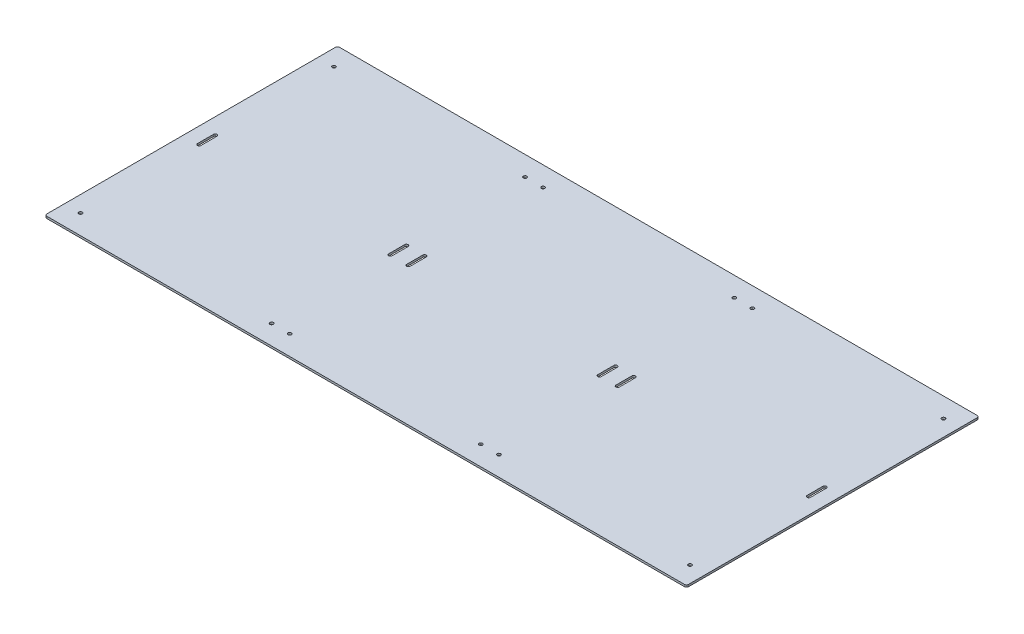
from build123d import *

# Parameters (mm, degrees)
SKETCH1_R           = 5.3578125
BOSS_EXTRUDE1_DEPTH = 6.35


with BuildPart() as part:
    # Sketch1 → Boss-Extrude1 (new body)
    with BuildSketch(Plane(origin=(0, 0, 0), x_dir=(1, 0, 0), z_dir=(0, 1, 0))):
        with BuildLine():
            Line((6.35, 0), (2019.3, 0))
            ThreePointArc((2019.3, 0), (2023.790128061, 1.859871939), (2025.65, 6.35))
            Line((2025.65, 6.35), (2025.65, 917.575))
            ThreePointArc((2025.65, 917.575), (2023.790128061, 922.065128061), (2019.3, 923.925))
            Line((2019.3, 923.925), (6.35, 923.925))
            ThreePointArc((6.35, 923.925), (1.859871939, 922.065128061), (0, 917.575))
            Line((0, 917.575), (0, 6.35))
            ThreePointArc((0, 6.35), (1.859871939, 1.859871939), (6.35, 0))
        make_face()
        with Locations(Location((50.8, 862.0125, 0), (0, 0, 270))):
            Circle(SKETCH1_R, mode=Mode.SUBTRACT)
        with Locations(Location((1974.85, 862.0125, 0), (0, 0, 270))):
            Circle(SKETCH1_R, mode=Mode.SUBTRACT)
        with Locations(Location((1974.85, 61.9125, 0), (0, 0, 270))):
            Circle(SKETCH1_R, mode=Mode.SUBTRACT)
        with Locations(Location((50.8, 61.9125, 0), (0, 0, 270))):
            Circle(SKETCH1_R, mode=Mode.SUBTRACT)
        with Locations(Location((654.05, 862.0125, 0), (0, 0, 270))):
            Circle(SKETCH1_R, mode=Mode.SUBTRACT)
        with Locations(Location((1371.6, 862.0125, 0), (0, 0, 270))):
            Circle(SKETCH1_R, mode=Mode.SUBTRACT)
        with Locations(Location((711.2, 862.0125, 0), (0, 0, 270))):
            Circle(SKETCH1_R, mode=Mode.SUBTRACT)
        with Locations(Location((711.2, 61.9125, 0), (0, 0, 270))):
            Circle(SKETCH1_R, mode=Mode.SUBTRACT)
        with Locations(Location((654.05, 61.9125, 0), (0, 0, 270))):
            Circle(SKETCH1_R, mode=Mode.SUBTRACT)
        with Locations(Location((1314.45, 862.0125, 0), (0, 0, 270))):
            Circle(SKETCH1_R, mode=Mode.SUBTRACT)
        with Locations(Location((1314.45, 61.9125, 0), (0, 0, 270))):
            Circle(SKETCH1_R, mode=Mode.SUBTRACT)
        with Locations(Location((1371.6, 61.9125, 0), (0, 0, 270))):
            Circle(SKETCH1_R, mode=Mode.SUBTRACT)
        with BuildLine():
            Line((56.1578125, 487.3625), (56.1578125, 436.5625))
            ThreePointArc((56.1578125, 436.5625), (50.8, 431.2046875), (45.4421875, 436.5625))
            Line((45.4421875, 436.5625), (45.4421875, 487.3625))
            ThreePointArc((45.4421875, 487.3625), (50.8, 492.7203125), (56.1578125, 487.3625))
        make_face(mode=Mode.SUBTRACT)
        with BuildLine():
            Line((659.407827246, 487.3625), (659.407827246, 436.5625))
            ThreePointArc((659.407827246, 436.5625), (654.050014746, 431.2046875), (648.692202246, 436.5625))
            Line((648.692202246, 436.5625), (648.692202246, 487.3625))
            ThreePointArc((648.692202246, 487.3625), (654.050014746, 492.7203125), (659.407827246, 487.3625))
        make_face(mode=Mode.SUBTRACT)
        with BuildLine():
            Line((716.5578125, 487.3625), (716.5578125, 436.5625))
            ThreePointArc((716.5578125, 436.5625), (711.2, 431.2046875), (705.8421875, 436.5625))
            Line((705.8421875, 436.5625), (705.8421875, 487.3625))
            ThreePointArc((705.8421875, 487.3625), (711.2, 492.7203125), (716.5578125, 487.3625))
        make_face(mode=Mode.SUBTRACT)
        with BuildLine():
            Line((1969.4921875, 487.3625), (1969.4921875, 436.5625))
            ThreePointArc((1969.4921875, 436.5625), (1974.85, 431.2046875), (1980.2078125, 436.5625))
            Line((1980.2078125, 436.5625), (1980.2078125, 487.3625))
            ThreePointArc((1980.2078125, 487.3625), (1974.85, 492.7203125), (1969.4921875, 487.3625))
        make_face(mode=Mode.SUBTRACT)
        with BuildLine():
            Line((1309.0921875, 487.3625), (1309.0921875, 436.5625))
            ThreePointArc((1309.0921875, 436.5625), (1314.45, 431.2046875), (1319.8078125, 436.5625))
            Line((1319.8078125, 436.5625), (1319.8078125, 487.3625))
            ThreePointArc((1319.8078125, 487.3625), (1314.45, 492.7203125), (1309.0921875, 487.3625))
        make_face(mode=Mode.SUBTRACT)
        with BuildLine():
            Line((1366.242172754, 487.3625), (1366.242172754, 436.5625))
            ThreePointArc((1366.242172754, 436.5625), (1371.599985254, 431.2046875), (1376.957797754, 436.5625))
            Line((1376.957797754, 436.5625), (1376.957797754, 487.3625))
            ThreePointArc((1376.957797754, 487.3625), (1371.599985254, 492.7203125), (1366.242172754, 487.3625))
        make_face(mode=Mode.SUBTRACT)
    extrude(amount=BOSS_EXTRUDE1_DEPTH)


solid = part.part
